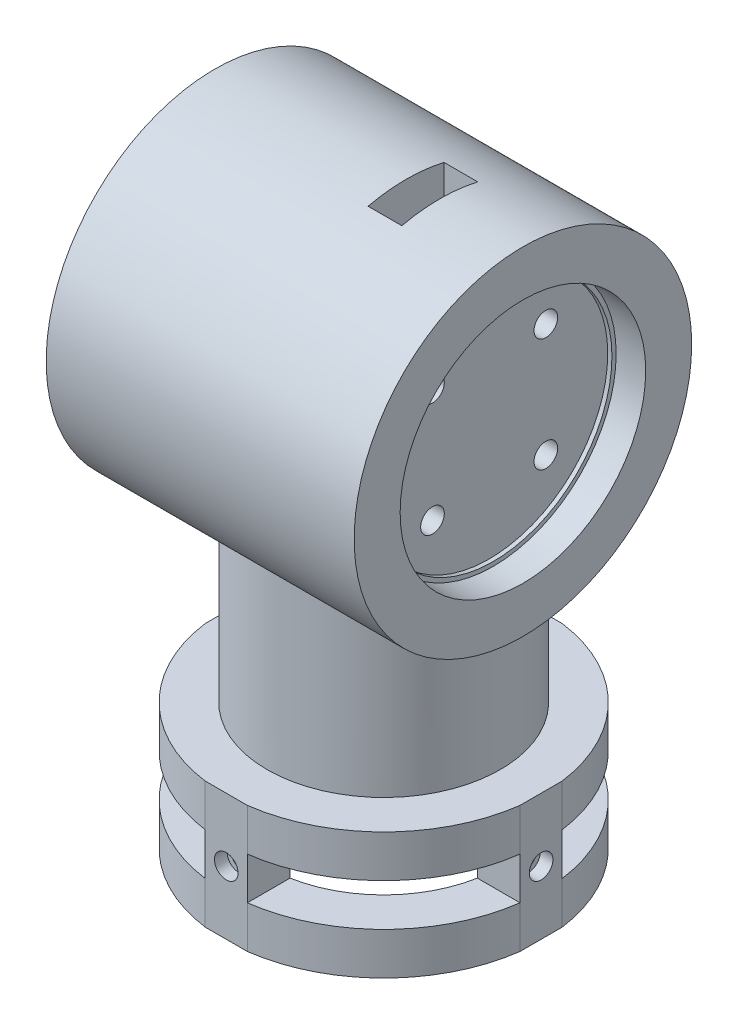
from build123d import *

# Parameters (mm, degrees)
SKETCH_1_R                      = 27.65
SKETCH_1_R_2                    = 17.65
EXTRUDE_1_DEPTH                 = 100
SKETCH_9_R                      = 37.65
SKETCH_9_R_2                    = 27.65
EXTRUDE_6_DEPTH                 = 30
EXTRUDE_8_DEPTH                 = 40
EXTRUDE_8_DEPTH_BACK            = 40
SKETCH_16_R                     = 40
SKETCH_16_R_2                   = 28.5
CUT_EXTRUDE_5_DEPTH             = 151.996688851
CUT_EXTRUDE_5_DEPTH_BACK        = 151.996688851
SKETCH_17_R                     = 28.5
CUT_EXTRUDE_6_REACH             = 152.997
SKETCH_19_R                     = 17.65
CUT_EXTRUDE_6_DIRECTION_2_DEPTH = 151.996688851
EXTRUDE_START                   = 30
SKETCH_20_R                     = 28.5
EXTRUDE_9_DEPTH                 = 16.7
CUT_EXTRUDE_7_REACH             = 152.997
SKETCH_21_W                     = 8
SKETCH_21_H                     = 18
EXTRUDE_START_2                 = 40
SKETCH_24_R                     = 28.5
SKETCH_24_R_2                   = 28
EXTRUDE_10_DEPTH                = 10
CUT_EXTRUDE_START               = -7
SKETCH_25_R                     = 40
CUT_EXTRUDE_8_DEPTH             = 7
CUT_EXTRUDE_START_2             = 10
CUT_EXTRUDE_9_DEPTH             = 10
CUT_EXTRUDE_10_DEPTH            = 20
CUT_EXTRUDE_START_3             = 33
SKETCH_28_R                     = 29.1
CUT_EXTRUDE_11_DEPTH            = 7
CUT_EXTRUDE_START_4             = 13.3
SKETCH_29_R                     = 28.6
CUT_EXTRUDE_12_DEPTH            = 165.296688851
CUT_EXTRUDE_13_DEPTH            = 30
SKETCH_31_R                     = 28.1
CUT_EXTRUDE_14_DEPTH            = 1
HOLE_WIZARD_M3_1_D              = 3.2
HOLE_WIZARD_M3_1_DEPTH          = 10.122354814
HOLE_WIZARD_M3_1_CBORE_D        = 5.6
HOLE_WIZARD_M3_1_CBORE_DEPTH    = 3
PATTERN_CIRCULAR_1_COUNT        = 4
HOLE_WIZARD_M3_2_D              = 3.2
HOLE_WIZARD_M3_2_CBORE_D        = 5.6
HOLE_WIZARD_M3_2_CBORE_DEPTH    = 5.7


with BuildPart() as part:
    # 草图1 → 凸台-拉伸1 (new body)
    with BuildSketch(Plane(origin=(0, 0, 0), x_dir=(1, 0, 0), z_dir=(0, 1, 0))):
        with Locations(Location((0, 0, 0), (0, 0, 90))):
            Circle(SKETCH_1_R)
        with Locations(Location((0, 0, 0), (0, 0, 90))):
            Circle(SKETCH_1_R_2, mode=Mode.SUBTRACT)
    extrude(amount=EXTRUDE_1_DEPTH)

    # 草图9 → 凸台-拉伸6 (add)
    with BuildSketch(Plane(origin=(0, 0, 0), x_dir=(1, 0, 0), z_dir=(0, 1, 0))):
        with Locations(Location((0, 0, 0), (0, 0, 270))):
            Circle(SKETCH_9_R)
        with Locations(Location((0, 0, 0), (0, 0, 90))):
            Circle(SKETCH_9_R_2, mode=Mode.SUBTRACT)
    extrude(amount=EXTRUDE_6_DEPTH)

    # 草图16 → 凸台-拉伸8 (add, two sides: drawn at the far end of the back side and taken through both)
    with BuildSketch(Plane(origin=(0, 0, 0), x_dir=(0, 0, -1), z_dir=(1, 0, 0)).offset(-EXTRUDE_8_DEPTH_BACK)):
        with Locations((0, 100)):
            Circle(SKETCH_16_R)
        with Locations((0, 100)):
            Circle(SKETCH_16_R_2, mode=Mode.SUBTRACT)
    extrude(amount=EXTRUDE_8_DEPTH + EXTRUDE_8_DEPTH_BACK)

    # 草图17 → 切除-拉伸5 (cut, two sides: drawn at the far end of the back side and taken through both)
    with BuildSketch(Plane(origin=(0, 0, 0), x_dir=(0, 0, -1), z_dir=(1, 0, 0)).offset(-CUT_EXTRUDE_5_DEPTH_BACK)):
        with Locations((0, 100)):
            Circle(SKETCH_17_R)
    extrude(amount=CUT_EXTRUDE_5_DEPTH + CUT_EXTRUDE_5_DEPTH_BACK, mode=Mode.SUBTRACT)

    # 草图19 → 切除-拉伸6 (cut, up to next)
    with BuildSketch(Plane.XZ, mode=Mode.PRIVATE) as cut_extrude_6_sk1:
        with Locations(Location((0, 0, 0), (0, 0, 270))):
            Circle(SKETCH_19_R)
    cut_extrude_6_tool1 = extrude(cut_extrude_6_sk1.sketch, amount=-CUT_EXTRUDE_6_REACH, mode=Mode.PRIVATE) & part.part
    add(cut_extrude_6_tool1.solids().sort_by_distance((0, 0, 0))[0], mode=Mode.SUBTRACT)

    # 草图19 → 切除-拉伸6 direction 2 (cut)
    with BuildSketch(Plane.XZ):
        with Locations(Location((0, 0, 0), (0, 0, 270))):
            Circle(SKETCH_19_R)
    extrude(amount=CUT_EXTRUDE_6_DIRECTION_2_DEPTH, mode=Mode.SUBTRACT)

    # 草图20 → 凸台-拉伸9 (add)
    with BuildSketch(Plane(origin=(0, 0, 0), x_dir=(0, 0, -1), z_dir=(1, 0, 0)).offset(EXTRUDE_START)):
        with Locations((0, 100)):
            Circle(SKETCH_20_R)
    extrude(amount=-EXTRUDE_9_DEPTH)

    # 草图21 → 切除-拉伸7 (cut, up to next)
    with BuildSketch(Plane(origin=(0, 0, 0), x_dir=(1, 0, 0), z_dir=(0, 1, 0)), mode=Mode.PRIVATE) as cut_extrude_7_sk1:
        with Locations((9.3, 0)):
            Rectangle(SKETCH_21_W, SKETCH_21_H)
    cut_extrude_7_tool1 = extrude(cut_extrude_7_sk1.sketch, amount=CUT_EXTRUDE_7_REACH, mode=Mode.PRIVATE) & part.part
    add(cut_extrude_7_tool1.solids().sort_by_distance((9.3, 0, 0))[0], mode=Mode.SUBTRACT)

    # 草图24 → 凸台-拉伸10 (add)
    with BuildSketch(Plane(origin=(0, 0, 0), x_dir=(0, 0, -1), z_dir=(1, 0, 0)).offset(EXTRUDE_START_2)):
        with Locations((0, 100)):
            Circle(SKETCH_24_R)
        with Locations((0, 100)):
            Circle(SKETCH_24_R_2, mode=Mode.SUBTRACT)
    extrude(amount=-EXTRUDE_10_DEPTH)

    # 草图25 → 切除-拉伸8 (cut)
    with BuildSketch(Plane(origin=(40, 0, 0), x_dir=(0, 0, -1), z_dir=(1, 0, 0)).offset(CUT_EXTRUDE_START)):
        with Locations((0, 100)):
            Circle(SKETCH_25_R)
    extrude(amount=CUT_EXTRUDE_8_DEPTH, mode=Mode.SUBTRACT)

    # 草图26 → 切除-拉伸9 (cut)
    with BuildSketch(Plane(origin=(0, 0, 0), x_dir=(1, 0, 0), z_dir=(0, 1, 0)).offset(CUT_EXTRUDE_START_2)):
        with BuildLine():
            Line((-27.194162977, 5), (-37.31651779, 5))
            ThreePointArc((-37.31651779, 5), (-26.622570312, 26.622570312), (-5, 37.31651779))
            Line((-5, 37.31651779), (-5, 27.194162977))
            ThreePointArc((-5, 27.194162977), (-19.5515025, 19.5515025), (-27.194162977, 5))
        make_face()
        with BuildLine():
            Line((5, 27.194162977), (5, 37.31651779))
            ThreePointArc((5, 37.31651779), (26.622570312, 26.622570312), (37.31651779, 5))
            Line((37.31651779, 5), (27.194162977, 5))
            ThreePointArc((27.194162977, 5), (19.5515025, 19.5515025), (5, 27.194162977))
        make_face()
        with BuildLine():
            Line((-27.194162977, -5), (-37.31651779, -5))
            ThreePointArc((-37.31651779, -5), (-26.622570312, -26.622570312), (-5, -37.31651779))
            Line((-5, -37.31651779), (-5, -27.194162977))
            ThreePointArc((-5, -27.194162977), (-19.5515025, -19.5515025), (-27.194162977, -5))
        make_face()
        with BuildLine():
            Line((5, -27.194162977), (5, -37.31651779))
            ThreePointArc((5, -37.31651779), (26.622570312, -26.622570312), (37.31651779, -5))
            Line((37.31651779, -5), (27.194162977, -5))
            ThreePointArc((27.194162977, -5), (19.5515025, -19.5515025), (5, -27.194162977))
        make_face()
    extrude(amount=CUT_EXTRUDE_9_DEPTH, mode=Mode.SUBTRACT)

    # 草图27 → 切除-拉伸10 (cut)
    with BuildSketch(Plane(origin=(0, 0, 0), x_dir=(1, 0, 0), z_dir=(0, 1, 0))):
        with BuildLine():
            Line((-5, 27.194162977), (5, 27.194162977))
            ThreePointArc((5, 27.194162977), (19.5515025, 19.5515025), (27.194162977, 5))
            Line((27.194162977, 5), (27.194162977, -5))
            ThreePointArc((27.194162977, -5), (19.5515025, -19.5515025), (5, -27.194162977))
            Line((5, -27.194162977), (-5, -27.194162977))
            ThreePointArc((-5, -27.194162977), (-19.5515025, -19.5515025), (-27.194162977, -5))
            Line((-27.194162977, -5), (-27.194162977, 5))
            ThreePointArc((-27.194162977, 5), (-19.5515025, 19.5515025), (-5, 27.194162977))
        make_face()
    extrude(amount=CUT_EXTRUDE_10_DEPTH, mode=Mode.SUBTRACT)

    # 草图28 → 切除-拉伸11 (cut)
    with BuildSketch(Plane(origin=(0, 0, 0), x_dir=(0, 0, -1), z_dir=(1, 0, 0)).offset(CUT_EXTRUDE_START_3)):
        with Locations((0, 100)):
            Circle(SKETCH_28_R)
    extrude(amount=-CUT_EXTRUDE_11_DEPTH, mode=Mode.SUBTRACT)

    # 草图29 → 切除-拉伸12 (cut, through all)
    with BuildSketch(Plane(origin=(0, 0, 0), x_dir=(0, 0, -1), z_dir=(1, 0, 0)).offset(CUT_EXTRUDE_START_4)):
        with Locations((0, 100)):
            Circle(SKETCH_29_R)
    extrude(amount=-CUT_EXTRUDE_12_DEPTH, mode=Mode.SUBTRACT)

    # 草图30 → 切除-拉伸13 (cut)
    with BuildSketch(Plane(origin=(0, 0, 0), x_dir=(1, 0, 0), z_dir=(0, 1, 0))):
        with BuildLine():
            Line((5, 37.31651779), (-5, 37.31651779))
            ThreePointArc((-5, 37.31651779), (0, 37.65), (5, 37.31651779))
        make_face()
        with BuildLine():
            Line((-37.31651779, 5), (-37.31651779, -5))
            ThreePointArc((-37.31651779, -5), (-37.65, 0), (-37.31651779, 5))
        make_face()
        with BuildLine():
            Line((-5, -37.31651779), (5, -37.31651779))
            ThreePointArc((5, -37.31651779), (0, -37.65), (-5, -37.31651779))
        make_face()
        with BuildLine():
            Line((37.31651779, -5), (37.31651779, 5))
            ThreePointArc((37.31651779, 5), (37.65, 0), (37.31651779, -5))
        make_face()
    extrude(amount=CUT_EXTRUDE_13_DEPTH, mode=Mode.SUBTRACT)

    # 草图31 → 切除-拉伸14 (cut)
    with BuildSketch(Plane(origin=(26, 0, 0), x_dir=(0, 0, -1), z_dir=(1, 0, 0))):
        with Locations((0, 100)):
            Circle(SKETCH_31_R)
    extrude(amount=-CUT_EXTRUDE_14_DEPTH, mode=Mode.SUBTRACT)

    # M3 六角头螺栓的柱形沉头孔1
    with Locations(Plane(origin=(37.31651779, 0, 0), x_dir=(0, 0, -1), z_dir=(1, 0, 0))):
        with Locations((0, 15)):
            hole_wizard_m3_1 = CounterBoreHole(HOLE_WIZARD_M3_1_D / 2, HOLE_WIZARD_M3_1_CBORE_D / 2, HOLE_WIZARD_M3_1_CBORE_DEPTH, depth=HOLE_WIZARD_M3_1_DEPTH)

    # 阵列(圆周)1: M3 六角头螺栓的柱形沉头孔1 ×4 about axis
    pattern_circular_1_axis = Axis((0, 0, 0), (0, 1, 0))
    for i in range(1, PATTERN_CIRCULAR_1_COUNT):
        add(hole_wizard_m3_1.rotate(pattern_circular_1_axis, i * 360 / PATTERN_CIRCULAR_1_COUNT), mode=Mode.SUBTRACT)

    # M3 六角头螺栓的柱形沉头孔2 (through all)
    with Locations(Plane(origin=(25, 0, 0), x_dir=(0, 0, -1), z_dir=(1, 0, 0))):
        with Locations((-13.435028843, 86.564971157), (-13.435028843, 113.435028843), (13.435028843, 113.435028843), (13.435028843, 86.564971157)):
            CounterBoreHole(HOLE_WIZARD_M3_2_D / 2, HOLE_WIZARD_M3_2_CBORE_D / 2, HOLE_WIZARD_M3_2_CBORE_DEPTH)


solid = part.part
